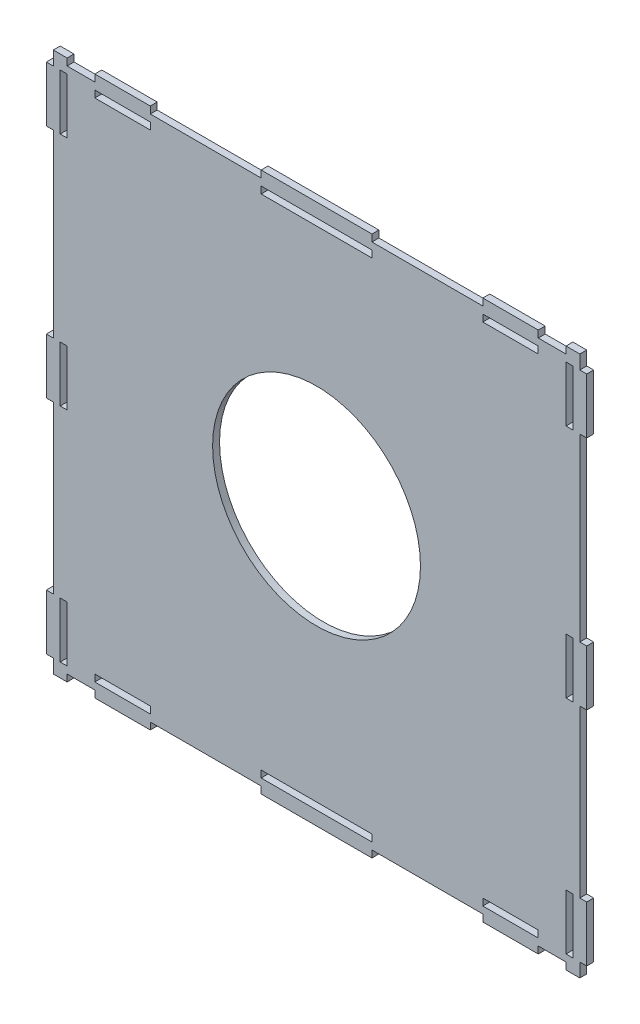
from build123d import *

# Parameters (mm, degrees)
ESQUISSE1_W        = 5
ESQUISSE1_H        = 40
ESQUISSE1_W_2      = 40
ESQUISSE1_H_2      = 5
ESQUISSE1_W_3      = 80
ESQUISSE1_R        = 75
BOSS_EXTRU_1_DEPTH = 5


with BuildPart() as part:
    # Esquisse1 → Boss.-Extru.1 (new body)
    with BuildSketch(Plane.XY):
        Polygon((-238.142492866, -253.406593407), (-238.142492866, -263.406593407), (-228.142492866, -263.406593407), (-228.142492866, -258.406593407), (-208.142492866, -258.406593407), (-208.142492866, -263.406593407), (-168.142492866, -263.406593407), (-168.142492866, -258.406593407), (-88.142492866, -258.406593407), (-88.142492866, -263.406593407), (-8.142492866, -263.406593407), (-8.142492866, -258.406593407), (71.857507134, -258.406593407), (71.857507134, -263.406593407), (111.857507134, -263.406593407), (111.857507134, -258.406593407), (131.857507134, -258.406593407), (131.857507134, -263.406593407), (141.857507134, -263.406593407), (141.857507134, -253.406593407), (146.857507134, -253.406593407), (146.857507134, -213.406593407), (141.857507134, -213.406593407), (141.857507134, -93.406593407), (146.857507134, -93.406593407), (146.857507134, -53.406593407), (141.857507134, -53.406593407), (141.857507134, 76.593406593), (146.857507134, 76.593406593), (146.857507134, 116.593406593), (141.857507134, 116.593406593), (141.857507134, 126.593406593), (131.857507134, 126.593406593), (131.857507134, 121.593406593), (111.857507134, 121.593406593), (111.857507134, 126.593406593), (71.857507134, 126.593406593), (71.857507134, 121.593406593), (-8.142492866, 121.593406593), (-8.142492866, 126.593406593), (-88.142492866, 126.593406593), (-88.142492866, 121.593406593), (-168.142492866, 121.593406593), (-168.142492866, 126.593406593), (-208.142492866, 126.593406593), (-208.142492866, 121.593406593), (-228.142492866, 121.593406593), (-228.142492866, 126.593406593), (-238.142492866, 126.593406593), (-238.142492866, 116.593406593), (-243.142492866, 116.593406593), (-243.142492866, 76.593406593), (-238.142492866, 76.593406593), (-238.142492866, -53.406593407), (-243.142492866, -53.406593407), (-243.142492866, -93.406593407), (-238.142492866, -93.406593407), (-238.142492866, -213.406593407), (-243.142492866, -213.406593407), (-243.142492866, -253.406593407), align=None)
        with Locations((134.357507134, -233.406593407)):
            Rectangle(ESQUISSE1_W, ESQUISSE1_H, mode=Mode.SUBTRACT)
        with Locations((134.357507134, -73.406593407)):
            Rectangle(ESQUISSE1_W, ESQUISSE1_H, mode=Mode.SUBTRACT)
        with Locations((134.357507134, 96.593406593)):
            Rectangle(ESQUISSE1_W, ESQUISSE1_H, mode=Mode.SUBTRACT)
        with Locations((91.857507134, 114.093406593)):
            Rectangle(ESQUISSE1_W_2, ESQUISSE1_H_2, mode=Mode.SUBTRACT)
        with Locations((-48.142492866, 114.093406593)):
            Rectangle(ESQUISSE1_W_3, ESQUISSE1_H_2, mode=Mode.SUBTRACT)
        with Locations((-188.142492866, 114.093406593)):
            Rectangle(ESQUISSE1_W_2, ESQUISSE1_H_2, mode=Mode.SUBTRACT)
        with Locations((-230.642492866, 96.593406593)):
            Rectangle(ESQUISSE1_W, ESQUISSE1_H, mode=Mode.SUBTRACT)
        with Locations((-230.642492866, -73.406593407)):
            Rectangle(ESQUISSE1_W, ESQUISSE1_H, mode=Mode.SUBTRACT)
        with Locations((-230.642492866, -233.406593407)):
            Rectangle(ESQUISSE1_W, ESQUISSE1_H, mode=Mode.SUBTRACT)
        with Locations((-188.142492866, -250.906593407)):
            Rectangle(ESQUISSE1_W_2, ESQUISSE1_H_2, mode=Mode.SUBTRACT)
        with Locations((-48.142492866, -250.906593407)):
            Rectangle(ESQUISSE1_W_3, ESQUISSE1_H_2, mode=Mode.SUBTRACT)
        with Locations((91.857507134, -250.906593407)):
            Rectangle(ESQUISSE1_W_2, ESQUISSE1_H_2, mode=Mode.SUBTRACT)
        with Locations((-48.142492866, -63.406593407)):
            Circle(ESQUISSE1_R, mode=Mode.SUBTRACT)
    extrude(amount=BOSS_EXTRU_1_DEPTH)


solid = part.part
